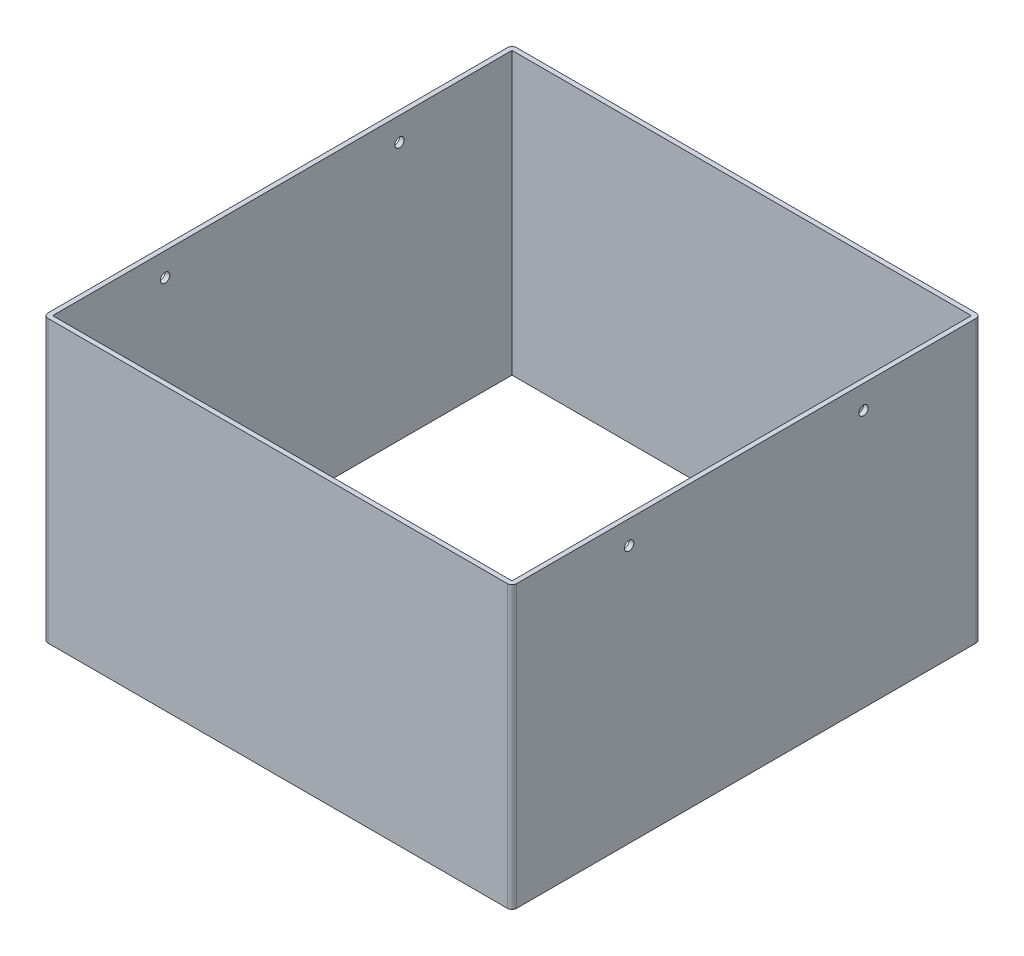
from build123d import *

# Parameters (mm, degrees)
SKETCH1_W           = 100
SKETCH1_H           = 100
BOSS_EXTRUDE1_DEPTH = 60
SKETCH2_W           = 98
SKETCH2_H           = 98
CUT_EXTRUDE1_DEPTH  = 225
SKETCH3_R           = 1
CUT_EXTRUDE2_DEPTH  = 118
FILLET1_R           = 1


with BuildPart() as part:
    # Sketch1 → Boss-Extrude1 (new body)
    with BuildSketch(Plane(origin=(0, 0, 0), x_dir=(1, 0, 0), z_dir=(0, 1, 0))):
        Rectangle(SKETCH1_W, SKETCH1_H)
    extrude(amount=BOSS_EXTRUDE1_DEPTH)

    # Sketch2 → Cut-Extrude1 (cut)
    with BuildSketch(Plane(origin=(0, 60, 0), x_dir=(1, 0, 0), z_dir=(0, 1, 0))):
        Rectangle(SKETCH2_W, SKETCH2_H)
    extrude(amount=-CUT_EXTRUDE1_DEPTH, mode=Mode.SUBTRACT)

    # Sketch3 → Cut-Extrude2 (cut)
    with BuildSketch(Plane.ZY.offset(50)):
        with BuildLine():
            ThreePointArc((-26, 55), (-25, 54), (-24, 55))
            Line((-24, 55), (-26, 55))
        make_face()
        with BuildLine():
            Line((-26, 55), (-24, 55))
            ThreePointArc((-24, 55), (-25, 56), (-26, 55))
        make_face()
        with Locations((25, 55)):
            Circle(SKETCH3_R)
    extrude(amount=-CUT_EXTRUDE2_DEPTH, mode=Mode.SUBTRACT)

    # Fillet1
    fillet1_edges = [part.edges().sort_by_distance(p)[0] for p in [
        (50, 30, 50),
        (-50, 30, 50),
        (-50, 30, -50),
        (50, 30, -50),
    ]]
    fillet(fillet1_edges, radius=FILLET1_R)


solid = part.part
